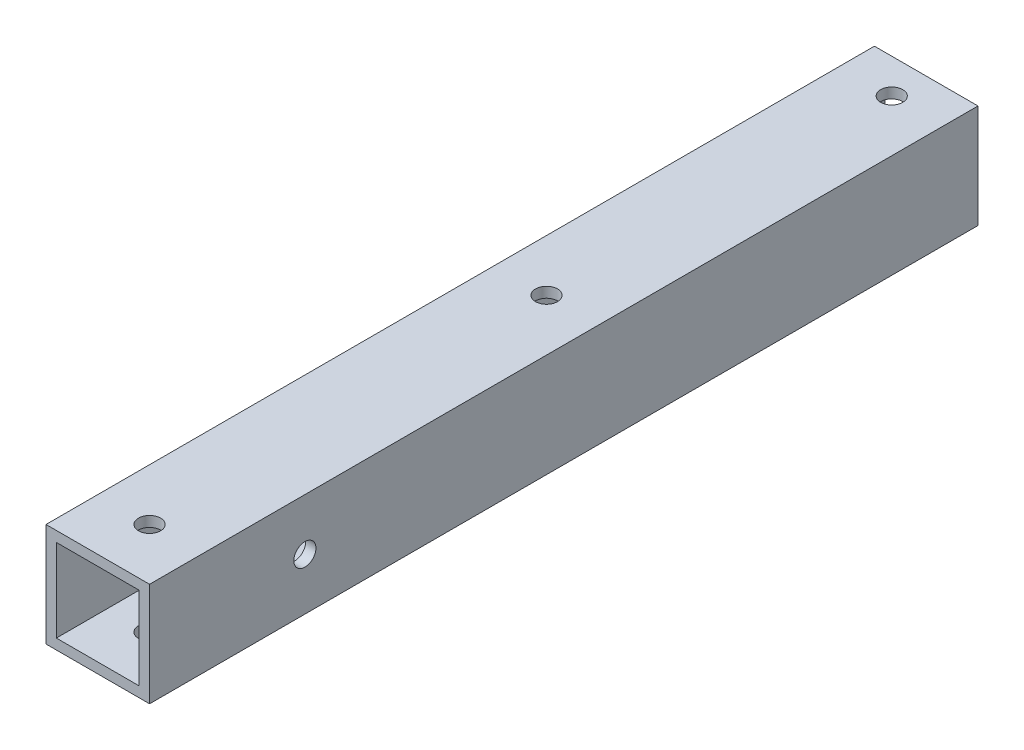
from build123d import *

# Parameters (mm, degrees)
SKETCH_1_W          = 15
SKETCH_1_H          = 15
SKETCH_1_W_2        = 12
SKETCH_1_H_2        = 12
EXTRUDE_1_DEPTH     = 120
SKETCH_2_R          = 1.6
CUT_EXTRUDE_1_DEPTH = 122.166208161
SKETCH_3_R          = 1.6
CUT_EXTRUDE_2_DEPTH = 122.166208161


with BuildPart() as part:
    # ｽｹｯﾁ1 → ﾎﾞｽ - 押し出し1 (new body)
    with BuildSketch(Plane.XY):
        Rectangle(SKETCH_1_W, SKETCH_1_H)
        Rectangle(SKETCH_1_W_2, SKETCH_1_H_2, mode=Mode.SUBTRACT)
    extrude(amount=EXTRUDE_1_DEPTH)

    # ｽｹｯﾁ2 → ｶｯﾄ - 押し出し1 (cut, through all)
    with BuildSketch(Plane(origin=(0, 7.5, 0), x_dir=(1, 0, 0), z_dir=(0, 1, 0))):
        with Locations(Location((0, -5, 0), (0, 0, 270))):
            Circle(SKETCH_2_R)
        with Locations(Location((0, -112.5, 0), (0, 0, 270))):
            Circle(SKETCH_2_R)
        with Locations(Location((0, -55, 0), (0, 0, 270))):
            Circle(SKETCH_2_R)
    extrude(amount=-CUT_EXTRUDE_1_DEPTH, mode=Mode.SUBTRACT)

    # ｽｹｯﾁ3 → ｶｯﾄ - 押し出し2 (cut, through all)
    with BuildSketch(Plane(origin=(7.5, 0, 0), x_dir=(0, 0, -1), z_dir=(1, 0, 0))):
        with Locations((-97.5, 0)):
            Circle(SKETCH_3_R)
    extrude(amount=-CUT_EXTRUDE_2_DEPTH, mode=Mode.SUBTRACT)


solid = part.part
